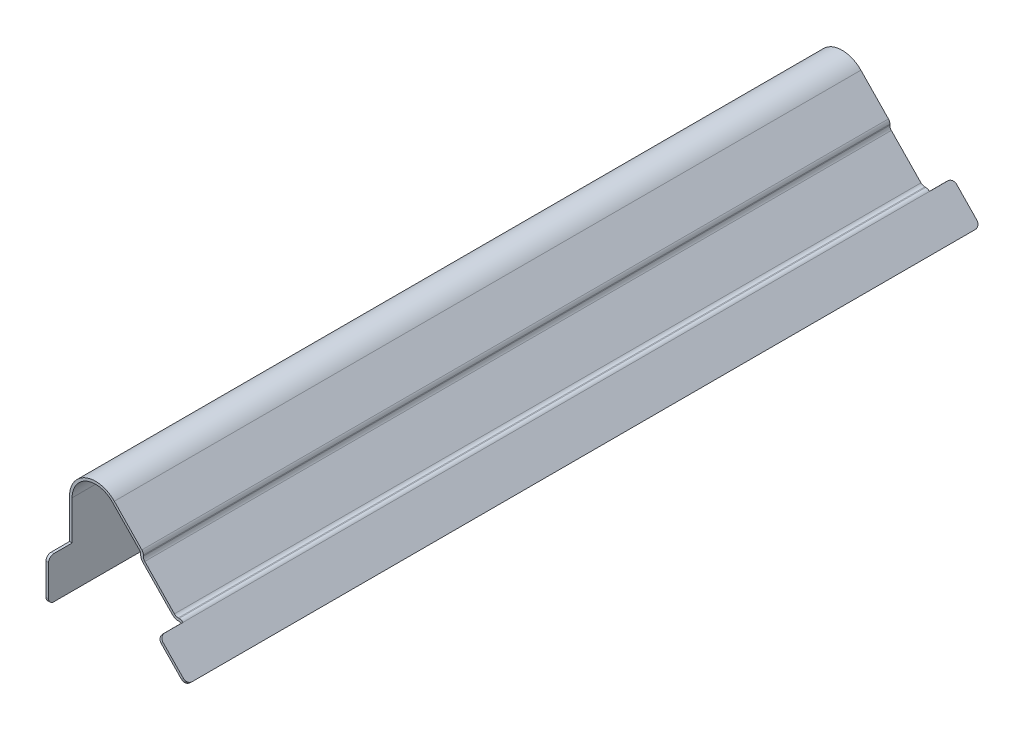
from build123d import *

# Parameters (mm, degrees)
BOSS_EXTRUDE1_DEPTH = 71.5
BOSS_EXTRUDE2_DEPTH = 0.5
BOSS_EXTRUDE3_DEPTH = 0.5


with BuildPart() as part:
    # Sketch1 → Boss-Extrude1 (new, symmetric)
    with BuildSketch(Plane.XY):
        with BuildLine():
            Line((0, 0), (0, 15.5))
            ThreePointArc((0, 15.5), (3.121859218, 20.133852307), (8.589034881, 18.981210799))
            Line((8.589034881, 18.981210799), (13.864340006, 13.54251283))
            ThreePointArc((13.864340006, 13.54251283), (14.078923552, 13.207723175), (14.146067988, 12.81577696))
            Line((14.146067988, 12.81577696), (14.140269037, 12.625696624))
            ThreePointArc((14.140269037, 12.625696624), (14.207413473, 12.233750409), (14.421997019, 11.898960755))
            Line((14.421997019, 11.898960755), (20.098912151, 6.04621365))
            ThreePointArc((20.098912151, 6.04621365), (20.427002666, 5.821520915), (20.816719127, 5.742455809))
            Line((20.816719127, 5.742455809), (21.006887899, 5.742455809))
            ThreePointArc((21.006887899, 5.742455809), (21.39660436, 5.663390704), (21.724694875, 5.438697969))
            Line((21.724694875, 5.438697969), (27, 0))
            Line((27, 0), (26.641096512, -0.34812108))
            Line((26.641096512, -0.34812108), (21.365791387, 5.090576889))
            ThreePointArc((21.365791387, 5.090576889), (21.20174613, 5.202923257), (21.006887899, 5.242455809))
            Line((21.006887899, 5.242455809), (20.816719127, 5.242455809))
            ThreePointArc((20.816719127, 5.242455809), (20.232144435, 5.361053468), (19.740008663, 5.69809257))
            Line((19.740008663, 5.69809257), (14.063093531, 11.550839675))
            ThreePointArc((14.063093531, 11.550839675), (13.741218212, 12.053024156), (13.640501557, 12.640943479))
            Line((13.640501557, 12.640943479), (13.646300509, 12.831023815))
            ThreePointArc((13.646300509, 12.831023815), (13.612728291, 13.026996922), (13.505436518, 13.19439175))
            Line((13.505436518, 13.19439175), (8.230131393, 18.633089719))
            ThreePointArc((8.230131393, 18.633089719), (3.309673296, 19.670467076), (0.5, 15.5))
            Line((0.5, 15.5), (0.5, 0))
            Line((0.5, 0), (0, 0))
        make_face()
    extrude(amount=BOSS_EXTRUDE1_DEPTH, both=True)

    # Sketch2 → Boss-Extrude2 (add)
    with BuildSketch(Plane(origin=(0, 0, 0), x_dir=(0, 0, -1), z_dir=(1, 0, 0))):
        with BuildLine():
            Line((-71.5, 0), (-75, 0))
            ThreePointArc((-75, 0), (-75.707106781, 0.292893219), (-76, 1))
            Line((-76, 1), (-76, 7))
            ThreePointArc((-76, 7), (-75.707106781, 7.707106781), (-75, 8))
            Line((-75, 8), (-71.5, 8))
            Line((-71.5, 8), (-71.5, 0))
        make_face()
        with BuildLine():
            Line((71.5, 8), (71.5, 0))
            Line((71.5, 0), (75, 0))
            ThreePointArc((75, 0), (75.707106781, 0.292893219), (76, 1))
            Line((76, 1), (76, 7))
            ThreePointArc((76, 7), (75.707106781, 7.707106781), (75, 8))
            Line((75, 8), (71.5, 8))
        make_face()
    extrude(amount=BOSS_EXTRUDE2_DEPTH)

    # Sketch3 → Boss-Extrude3 (add)
    with BuildSketch(Plane(origin=(13.911665086, 13.493721942, 0), x_dir=(0, 0, -1), z_dir=(0.7178069761649953, 0.696242159718058, 0))):
        with BuildLine():
            Line((-71.5, -11.221713136), (-75, -11.221713136))
            ThreePointArc((-75, -11.221713136), (-75.707106781, -11.514606354), (-76, -12.221713136))
            Line((-76, -12.221713136), (-76, -17.798538312))
            ThreePointArc((-76, -17.798538312), (-75.707106781, -18.505645094), (-75, -18.798538312))
            Line((-75, -18.798538312), (-71.5, -18.798538312))
            Line((-71.5, -18.798538312), (-71.5, -11.221713136))
        make_face()
        with BuildLine():
            Line((71.5, -18.798538312), (71.5, -11.221713136))
            Line((71.5, -11.221713136), (75, -11.221713136))
            ThreePointArc((75, -11.221713136), (75.707106781, -11.514606354), (76, -12.221713136))
            Line((76, -12.221713136), (76, -17.798538312))
            ThreePointArc((76, -17.798538312), (75.707106781, -18.505645094), (75, -18.798538312))
            Line((75, -18.798538312), (71.5, -18.798538312))
        make_face()
    extrude(amount=-BOSS_EXTRUDE3_DEPTH)


solid = part.part
